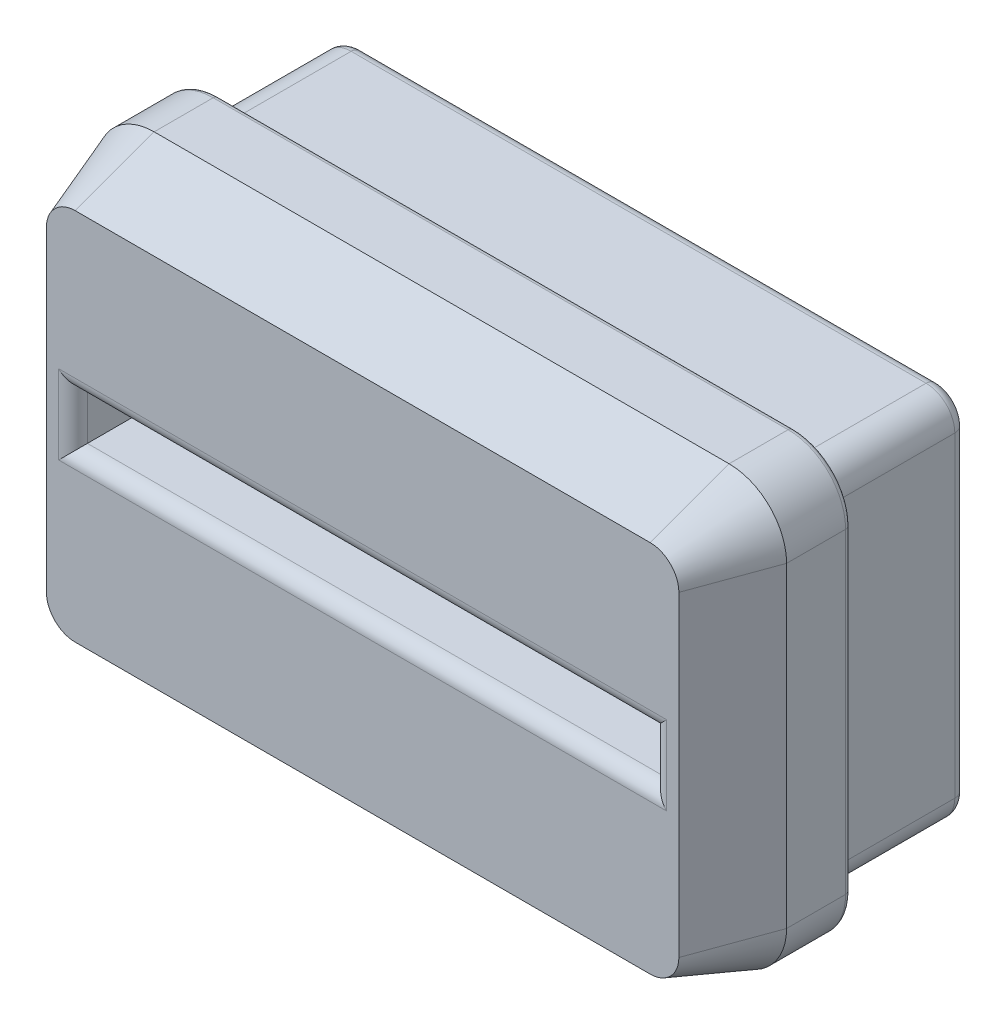
from build123d import *

# Parameters (mm, degrees)
SKETCH1_W           = 24
SKETCH1_H           = 13
BOSS_EXTRUDE1_DEPTH = 15
SKETCH2_W           = 20.15
SKETCH2_H           = 1.75
CUT_EXTRUDE1_DEPTH  = 15
FILLET1_R           = 2
CHAMFER2_SIZE       = 1
CHAMFER2_SIZE2      = 2.747477419
FILLET2_R           = 0.5
CUT_EXTRUDE4_DEPTH  = 11
SKETCH5_W           = 26.855674208
SKETCH5_H           = 19.307728506
CUT_EXTRUDE5_DEPTH  = 8
CUT_EXTRUDE6_DEPTH  = 11
SKETCH7_W           = 29.982721697
SKETCH7_H           = 21.559004648
CUT_EXTRUDE7_DEPTH  = 3
CHAMFER3_SIZE       = 2
FILLET3_R           = 0.4
FILLET4_R           = 0.2


with BuildPart() as part:
    # Sketch1 → Boss-Extrude1 (new body)
    with BuildSketch(Plane(origin=(0, 0, 0), x_dir=(1, 0, 0), z_dir=(0, 1, 0))):
        Rectangle(SKETCH1_W, SKETCH1_H)
    extrude(amount=BOSS_EXTRUDE1_DEPTH)

    # Sketch2 → Cut-Extrude1 (cut)
    with BuildSketch(Plane.XY.offset(6.5)):
        with Locations((0, 7.575)):
            Rectangle(SKETCH2_W, SKETCH2_H)
    extrude(amount=-CUT_EXTRUDE1_DEPTH, mode=Mode.SUBTRACT)

    # Fillet1
    fillet1_edges = [part.edges().sort_by_distance(p)[0] for p in [
        (-12, 15, 0),
        (12, 15, 0),
        (-12, 0, 0),
        (12, 0, 0),
    ]]
    fillet(fillet1_edges, radius=FILLET1_R)

    # Chamfer2
    chamfer2_edges = [part.edges().sort_by_distance(p)[0] for p in [
        (0, 15, 6.5),
        (12, 7.5, 6.5),
        (0, 0, 6.5),
        (-12, 7.5, 6.5),
        (-11.414213562, 14.414213562, 6.5),
        (-11.414213562, 0.585786438, 6.5),
        (11.414213562, 0.585786438, 6.5),
        (11.414213562, 14.414213562, 6.5),
    ]]
    chamfer2_side = [part.faces().sort_by_distance(p)[0] for p in [
        (11.716980566, 7.5, 6.5),
    ]]
    chamfer(chamfer2_edges, length=CHAMFER2_SIZE, length2=CHAMFER2_SIZE2, reference=chamfer2_side[0])

    # Fillet2
    fillet2_edges = [part.edges().sort_by_distance(p)[0] for p in [
        (10.075, 7.575, 6.5),
        (0, 8.45, 6.5),
        (-10.075, 7.575, 6.5),
        (0, 6.7, 6.5),
    ]]
    fillet(fillet2_edges, radius=FILLET2_R)

    # Sketch4 → Cut-Extrude4 (cut)
    with BuildSketch(Plane(origin=(0, 0, -6.5), x_dir=(-1, 0, 0), z_dir=(0, 0, -1))):
        Polygon((-10.075, 8.45), (-8.575, 8.45), (-8.575, 11.891155889), (8.575, 11.891155889), (8.575, 8.45), (10.075, 8.45), (10.075, 6.7), (-10.075, 6.7), align=None)
    extrude(amount=-CUT_EXTRUDE4_DEPTH, mode=Mode.SUBTRACT)

    # Sketch5 → Cut-Extrude5 (cut)
    with BuildSketch(Plane(origin=(0, 0, -6.5), x_dir=(-1, 0, 0), z_dir=(0, 0, -1))):
        with Locations((-0.083402715, 7.762018115)):
            Rectangle(SKETCH5_W, SKETCH5_H)
        with BuildLine():
            Line((10, 14), (-10, 14))
            ThreePointArc((-10, 14), (-10.707106781, 13.707106781), (-11, 13))
            Line((-11, 13), (-11, 2))
            ThreePointArc((-11, 2), (-10.707106781, 1.292893219), (-10, 1))
            Line((-10, 1), (10, 1))
            ThreePointArc((10, 1), (10.707106781, 1.292893219), (11, 2))
            Line((11, 2), (11, 13))
            ThreePointArc((11, 13), (10.707106781, 13.707106781), (10, 14))
        make_face(mode=Mode.SUBTRACT)
    extrude(amount=-CUT_EXTRUDE5_DEPTH, mode=Mode.SUBTRACT)

    # Sketch6 → Cut-Extrude6 (cut)
    with BuildSketch(Plane(origin=(0, 0, -6.5), x_dir=(-1, 0, 0), z_dir=(0, 0, -1))):
        with BuildLine():
            Line((-9, 5.7), (9, 5.7))
            ThreePointArc((9, 5.7), (9.707106781, 5.407106781), (10, 4.7))
            Line((10, 4.7), (10, 3))
            ThreePointArc((10, 3), (9.707106781, 2.292893219), (9, 2))
            Line((9, 2), (-9, 2))
            ThreePointArc((-9, 2), (-9.707106781, 2.292893219), (-10, 3))
            Line((-10, 3), (-10, 4.7))
            ThreePointArc((-10, 4.7), (-9.707106781, 5.407106781), (-9, 5.7))
        make_face()
    extrude(amount=-CUT_EXTRUDE6_DEPTH, mode=Mode.SUBTRACT)

    # Sketch7 → Cut-Extrude7 (cut)
    with BuildSketch(Plane(origin=(0, 0, -6.5), x_dir=(-1, 0, 0), z_dir=(0, 0, -1))):
        with Locations((0.615824589, 7.279559508)):
            Rectangle(SKETCH7_W, SKETCH7_H)
    extrude(amount=-CUT_EXTRUDE7_DEPTH, mode=Mode.SUBTRACT)

    # Chamfer3
    chamfer3_edges = [part.edges().sort_by_distance(p)[0] for p in [
        (9.325, 8.45, -3.5),
        (-9.325, 8.45, -3.5),
    ]]
    chamfer(chamfer3_edges, length=CHAMFER3_SIZE)

    # Fillet3
    fillet3_edges = [part.edges().sort_by_distance(p)[0] for p in [
        (-10, 3.85, -3.5),
        (0, 14, -3.5),
        (-10.707106781, 13.707106781, -3.5),
        (-11, 7.5, -3.5),
        (-10.707106781, 1.292893219, -3.5),
        (0, 1, -3.5),
        (10.707106781, 1.292893219, -3.5),
        (11, 7.5, -3.5),
        (10.707106781, 13.707106781, -3.5),
        (0, 6.7, -3.5),
        (0, 11.891155889, -3.5),
        (-8.575, 11.170577944, -3.5),
        (-9.707106781, 2.292893219, -3.5),
        (0, 2, -3.5),
        (9.707106781, 2.292893219, -3.5),
        (10, 3.85, -3.5),
        (9.707106781, 5.407106781, -3.5),
        (0, 5.7, -3.5),
        (-9.707106781, 5.407106781, -3.5),
        (8.575, 11.170577944, -3.5),
        (-9.325, 10.45, -3.5),
        (9.325, 10.45, -3.5),
    ]]
    fillet(fillet3_edges, radius=FILLET3_R)

    # Fillet4
    fillet4_edges = [part.edges().sort_by_distance(p)[0] for p in [
        (-11.414213562, 14.414213562, 1.5),
        (0, 0, 1.5),
        (-12, 7.5, 1.5),
        (12, 7.5, 1.5),
        (11.414213562, 0.585786438, 1.5),
        (11.414213562, 14.414213562, 1.5),
        (0, 15, 1.5),
        (-11.414213562, 0.585786438, 1.5),
    ]]
    fillet(fillet4_edges, radius=FILLET4_R)


solid = part.part
